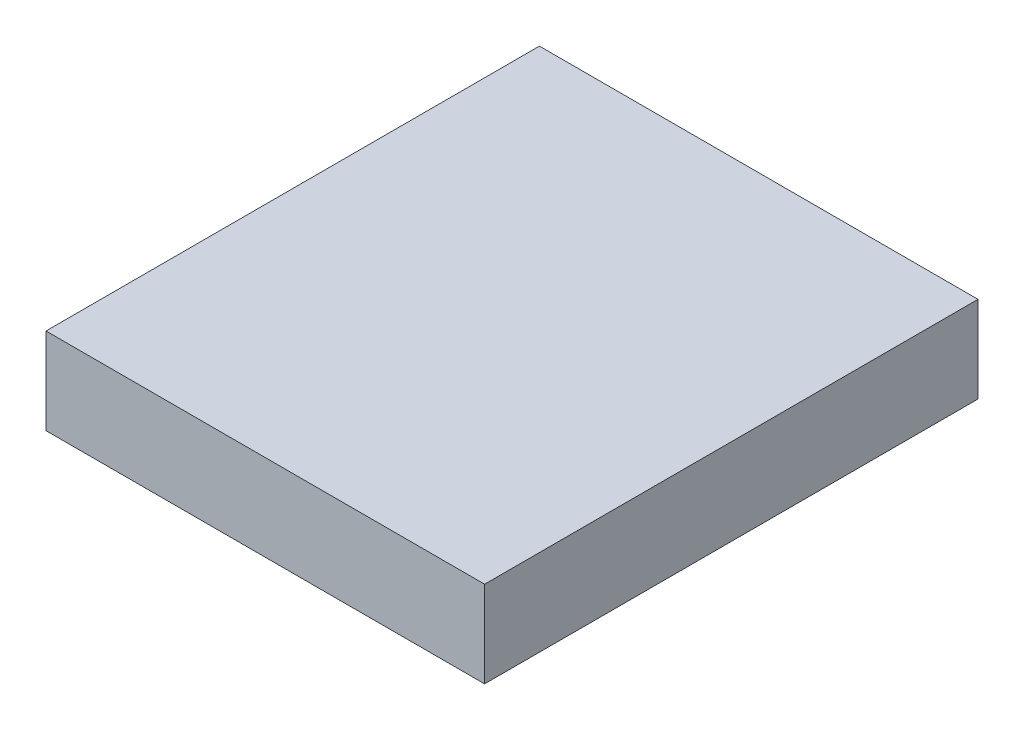
from build123d import *

# Parameters (mm, degrees)
SKETCH1_W           = 101.6
SKETCH1_H           = 114.3
BOSS_EXTRUDE1_DEPTH = 20


with BuildPart() as part:
    # Sketch1 → Boss-Extrude1 (new body)
    with BuildSketch(Plane(origin=(0, 0, 0), x_dir=(1, 0, 0), z_dir=(0, 1, 0))):
        Rectangle(SKETCH1_W, SKETCH1_H)
    extrude(amount=BOSS_EXTRUDE1_DEPTH)


solid = part.part
